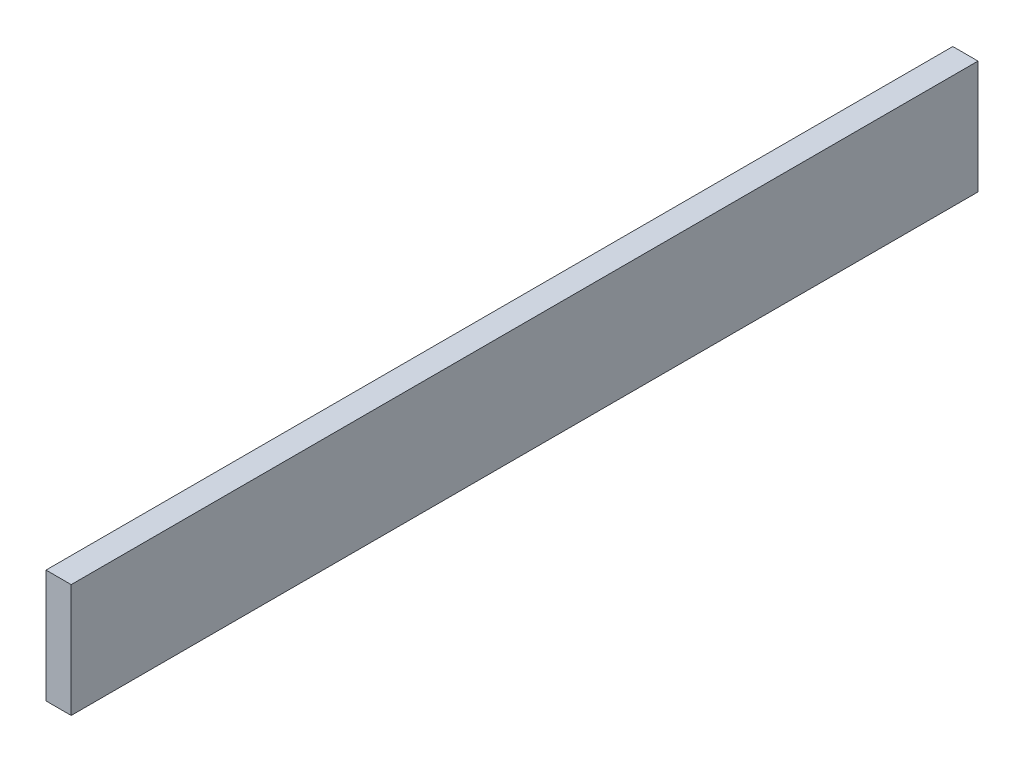
from build123d import *

# Parameters (mm, degrees)
ESQUISSE1_W        = 720
ESQUISSE1_H        = 90
BOSS_EXTRU_1_DEPTH = 20


with BuildPart() as part:
    # Esquisse1 → Boss.-Extru.1 (new body)
    with BuildSketch(Plane(origin=(0, 0, 0), x_dir=(0, 0, -1), z_dir=(1, 0, 0))):
        with Locations((232.107417894, -16.230450587)):
            Rectangle(ESQUISSE1_W, ESQUISSE1_H)
    extrude(amount=BOSS_EXTRU_1_DEPTH)


solid = part.part
